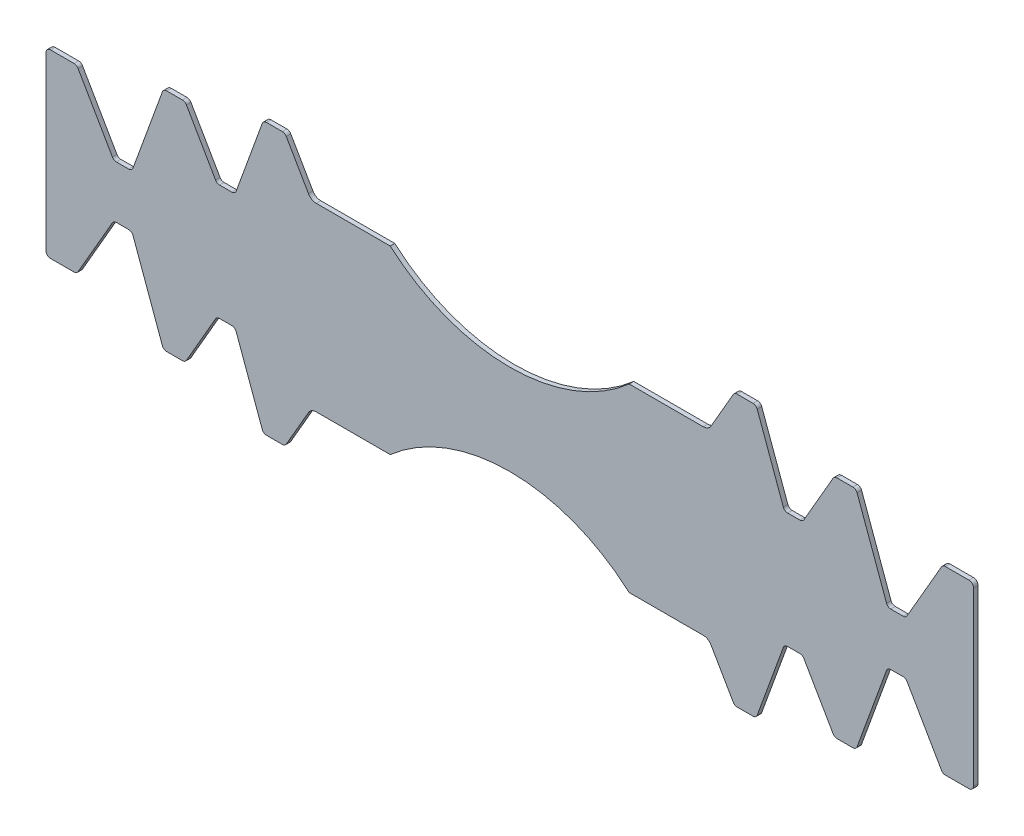
from build123d import *

# Parameters (mm, degrees)
BOSS_EXTRUDE1_DEPTH = 0.5


with BuildPart() as part:
    # Model → Boss-Extrude1 (new body)
    with BuildSketch(Plane.XY):
        with BuildLine():
            Line((1561.604350415, 393.6), (1562.977857238, 393.6))
            ThreePointArc((1562.977857238, 393.6), (1563.227857238, 393.533012702), (1563.41086994, 393.35))
            Line((1563.41086994, 393.35), (1566.644031447, 387.75))
            ThreePointArc((1566.644031447, 387.75), (1566.827044149, 387.566987298), (1567.077044149, 387.5))
            Line((1567.077044149, 387.5), (1568.831847468, 387.5))
            ThreePointArc((1568.831847468, 387.5), (1569.118635686, 387.590423978), (1569.301693779, 387.828989928))
            Line((1569.301693779, 387.828989928), (1572.556322945, 396.771010072))
            ThreePointArc((1572.556322945, 396.771010072), (1572.739381037, 397.009576022), (1573.026169255, 397.1))
            Line((1573.026169255, 397.1), (1574.399676079, 397.1))
            ThreePointArc((1574.399676079, 397.1), (1574.649676079, 397.033012702), (1574.83268878, 396.85))
            Line((1574.83268878, 396.85), (1578.643200557, 390.25))
            ThreePointArc((1578.643200557, 390.25), (1578.826213259, 390.066987298), (1579.076213259, 390))
            Line((1579.076213259, 390), (1581.687538124, 390))
            ThreePointArc((1581.687538124, 390), (1582.041091515, 390.146446609), (1582.187538124, 390.5))
            Line((1582.187538124, 390.5), (1582.187538124, 409.5))
            ThreePointArc((1582.187538124, 409.5), (1582.041091515, 409.853553391), (1581.687538124, 410))
            Line((1581.687538124, 410), (1579.076213259, 410))
            ThreePointArc((1579.076213259, 410), (1578.826213259, 409.933012702), (1578.643200557, 409.75))
            Line((1578.643200557, 409.75), (1574.83268878, 403.15))
            ThreePointArc((1574.83268878, 403.15), (1574.649676079, 402.966987298), (1574.399676079, 402.9))
            Line((1574.399676079, 402.9), (1573.026169255, 402.9))
            ThreePointArc((1573.026169255, 402.9), (1572.739381037, 402.990423978), (1572.556322945, 403.228989928))
            Line((1572.556322945, 403.228989928), (1569.301693779, 412.171010072))
            ThreePointArc((1569.301693779, 412.171010072), (1569.118635686, 412.409576022), (1568.831847468, 412.5))
            Line((1568.831847468, 412.5), (1567.077044149, 412.5))
            ThreePointArc((1567.077044149, 412.5), (1566.827044149, 412.433012702), (1566.644031447, 412.25))
            Line((1566.644031447, 412.25), (1563.41086994, 406.65))
            ThreePointArc((1563.41086994, 406.65), (1563.227857238, 406.466987298), (1562.977857238, 406.4))
            Line((1562.977857238, 406.4), (1561.604350415, 406.4))
            ThreePointArc((1561.604350415, 406.4), (1561.317562197, 406.490423978), (1561.134504104, 406.728989928))
            Line((1561.134504104, 406.728989928), (1558.243845172, 414.671010072))
            ThreePointArc((1558.243845172, 414.671010072), (1558.06078708, 414.909576022), (1557.773998862, 415))
            Line((1557.773998862, 415), (1556.019195543, 415))
            ThreePointArc((1556.019195543, 415), (1555.769195543, 414.933012702), (1555.586182841, 414.75))
            Line((1555.586182841, 414.75), (1553.132444197, 410.5))
            ThreePointArc((1553.132444197, 410.5), (1552.766418793, 410.133974596), (1552.266418793, 410))
            Line((1552.266418793, 410), (1544.072525617, 410))
            ThreePointArc((1544.072525617, 410), (1530.843769062, 405), (1517.615012507, 410))
            Line((1517.615012507, 410), (1509.421119331, 410))
            ThreePointArc((1509.421119331, 410), (1508.921119331, 410.133974596), (1508.555093928, 410.5))
            Line((1508.555093928, 410.5), (1506.101355284, 414.75))
            ThreePointArc((1506.101355284, 414.75), (1505.918342582, 414.933012702), (1505.668342582, 415))
            Line((1505.668342582, 415), (1503.913539263, 415))
            ThreePointArc((1503.913539263, 415), (1503.626751044, 414.909576022), (1503.443692952, 414.671010072))
            Line((1503.443692952, 414.671010072), (1500.55303402, 406.728989928))
            ThreePointArc((1500.55303402, 406.728989928), (1500.369975928, 406.490423978), (1500.08318771, 406.4))
            Line((1500.08318771, 406.4), (1498.709680887, 406.4))
            ThreePointArc((1498.709680887, 406.4), (1498.459680886, 406.466987298), (1498.276668185, 406.65))
            Line((1498.276668185, 406.65), (1495.043506677, 412.25))
            ThreePointArc((1495.043506677, 412.25), (1494.860493975, 412.433012702), (1494.610493975, 412.5))
            Line((1494.610493975, 412.5), (1492.855690656, 412.5))
            ThreePointArc((1492.855690656, 412.5), (1492.568902438, 412.409576022), (1492.385844346, 412.171010072))
            Line((1492.385844346, 412.171010072), (1489.131215179, 403.228989928))
            ThreePointArc((1489.131215179, 403.228989928), (1488.948157087, 402.990423978), (1488.661368869, 402.9))
            Line((1488.661368869, 402.9), (1487.287862046, 402.9))
            ThreePointArc((1487.287862046, 402.9), (1487.037862046, 402.966987298), (1486.854849344, 403.15))
            Line((1486.854849344, 403.15), (1483.044337567, 409.75))
            ThreePointArc((1483.044337567, 409.75), (1482.861324865, 409.933012702), (1482.611324865, 410))
            Line((1482.611324865, 410), (1480, 410))
            ThreePointArc((1480, 410), (1479.646446609, 409.853553391), (1479.5, 409.5))
            Line((1479.5, 409.5), (1479.5, 390.5))
            ThreePointArc((1479.5, 390.5), (1479.646446609, 390.146446609), (1480, 390))
            Line((1480, 390), (1482.611324865, 390))
            ThreePointArc((1482.611324865, 390), (1482.861324865, 390.066987298), (1483.044337567, 390.25))
            Line((1483.044337567, 390.25), (1486.854849344, 396.85))
            ThreePointArc((1486.854849344, 396.85), (1487.037862046, 397.033012702), (1487.287862046, 397.1))
            Line((1487.287862046, 397.1), (1488.661368869, 397.1))
            ThreePointArc((1488.661368869, 397.1), (1488.948157087, 397.009576022), (1489.131215179, 396.771010072))
            Line((1489.131215179, 396.771010072), (1492.385844346, 387.828989928))
            ThreePointArc((1492.385844346, 387.828989928), (1492.568902438, 387.590423978), (1492.855690656, 387.5))
            Line((1492.855690656, 387.5), (1494.610493975, 387.5))
            ThreePointArc((1494.610493975, 387.5), (1494.860493975, 387.566987298), (1495.043506677, 387.75))
            Line((1495.043506677, 387.75), (1498.276668185, 393.35))
            ThreePointArc((1498.276668185, 393.35), (1498.459680886, 393.533012702), (1498.709680887, 393.6))
            Line((1498.709680887, 393.6), (1500.08318771, 393.6))
            ThreePointArc((1500.08318771, 393.6), (1500.369975928, 393.509576022), (1500.55303402, 393.271010072))
            Line((1500.55303402, 393.271010072), (1503.443692952, 385.328989928))
            ThreePointArc((1503.443692952, 385.328989928), (1503.626751044, 385.090423978), (1503.913539263, 385))
            Line((1503.913539263, 385), (1505.668342582, 385))
            ThreePointArc((1505.668342582, 385), (1505.918342582, 385.066987298), (1506.101355283, 385.25))
            Line((1506.101355283, 385.25), (1508.555093928, 389.5))
            ThreePointArc((1508.555093928, 389.5), (1508.921119331, 389.866025404), (1509.421119331, 390))
            Line((1509.421119331, 390), (1517.615012507, 390))
            ThreePointArc((1517.615012507, 390), (1530.843769062, 395), (1544.072525618, 390))
            Line((1544.072525618, 390), (1552.266418793, 390))
            ThreePointArc((1552.266418793, 390), (1552.766418793, 389.866025404), (1553.132444197, 389.5))
            Line((1553.132444197, 389.5), (1555.586182841, 385.25))
            ThreePointArc((1555.586182841, 385.25), (1555.769195543, 385.066987298), (1556.019195543, 385))
            Line((1556.019195543, 385), (1557.773998862, 385))
            ThreePointArc((1557.773998862, 385), (1558.06078708, 385.090423978), (1558.243845172, 385.328989928))
            Line((1558.243845172, 385.328989928), (1561.134504104, 393.271010072))
            ThreePointArc((1561.134504104, 393.271010072), (1561.317562197, 393.509576022), (1561.604350415, 393.6))
        make_face()
    extrude(amount=BOSS_EXTRUDE1_DEPTH)


solid = part.part
